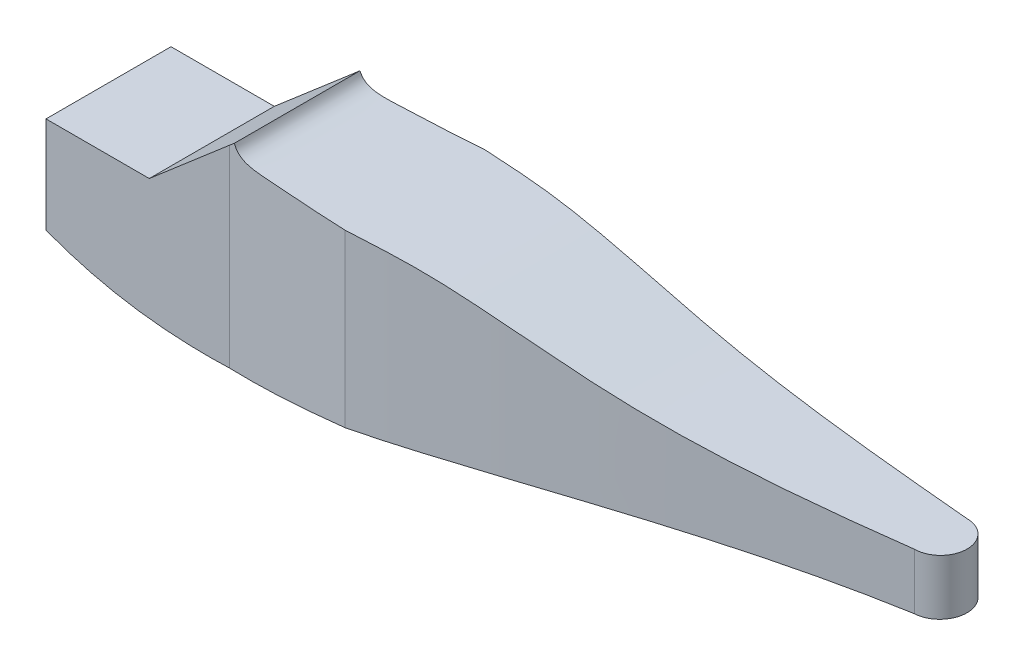
from build123d import *

# Parameters (mm, degrees)
CUERPOPRINCIPAL_DEPTH      = 80
CUERPOPRINCIPAL_DEPTH_BACK = 80
CROQUIS7_W                 = 766.54141339
CROQUIS7_H                 = 186.814047896
CORTAR_EXTRUIR3_DEPTH      = 424.189661213


with BuildPart() as part:
    # Croquis6 → CuerpoPrincipal (new, two sides: drawn at the far end of the back side and taken through both)
    with BuildSketch(Plane.XY.offset(-CUERPOPRINCIPAL_DEPTH_BACK)):
        with BuildLine():
            Line((-389.911285637, 0), (-389.911285637, 10))
            Line((-389.911285637, 10), (-314.911285637, 10))
            Line((-314.911285637, 10), (-252.842026432, 63.342743249))
            add(Edge.make_bspline(
                [(-252.842026432, 63.342743249), (-249.563571816, 53.509504255), (-229.736767838, 54.456579909), (-175.745984322, 53.062372026), (-106.068484535, 58.585938297), (54.065899345, 26.702801366), (176.576576864, 30.145854915), (260.088714363, 30)],
                knots=[0, 0, 0, 0, 0.061032802, 0.08831328, 0.27280478, 0.517876898, 1, 1, 1, 1], degree=3))
            Line((260.088714363, 30), (260.088714363, 0))
            Line((260.088714363, 0), (260.088714363, -10))
            add(Edge.make_bspline(
                [(-389.911285637, -60), (-298.802521335, -94.939625713), (-162.47070916, -70.499248703), (51.2930938, -26.3000961), (176.665472183, -9.193630881), (260.088714363, -10)],
                knots=[0, 0, 0, 0, 0.425340355, 0.619701838, 1, 1, 1, 1], degree=3))
            Line((-389.911285637, -60), (-389.911285637, 0))
        make_face()
    extrude(amount=CUERPOPRINCIPAL_DEPTH + CUERPOPRINCIPAL_DEPTH_BACK)

    # Croquis7 → Cortar-Extruir3 (cut, through all)
    with BuildSketch(Plane(origin=(0, 63.342743249, 0), x_dir=(1, 0, 0), z_dir=(0, 1, 0))):
        with Locations((-111.935875123, 0)):
            Rectangle(CROQUIS7_W, CROQUIS7_H)
        with BuildLine():
            Line((-256.600146606, -47.774811313), (-393.48095316, -47.774811313))
            Line((-393.48095316, -47.774811313), (-393.48095316, 43.013414242))
            Line((-393.48095316, 43.013414242), (-256.600146606, 43.013414242))
            Line((-256.600146606, 43.013414242), (-167.005663578, 47.988111532))
            add(Edge.make_bspline(
                [(-167.005663578, 47.988111532), (24.572527119, 33.232019495), (215.882298238, 15.311011059)],
                knots=[0, 0, 0, 1, 1, 1], degree=2))
            ThreePointArc((215.882298238, 15.311011059), (235.051976592, -3.858667295), (215.882298238, -23.028345648))
            add(Edge.make_bspline(
                [(-167.005663578, -53.371345765), (25.138803047, -47.402429077), (215.882298238, -23.028345648)],
                knots=[0, 0, 0, 1, 1, 1], degree=2))
            Line((-167.005663578, -53.371345765), (-256.600146606, -47.774811313))
        make_face(mode=Mode.SUBTRACT)
    extrude(amount=-CORTAR_EXTRUIR3_DEPTH, mode=Mode.SUBTRACT)


solid = part.part
